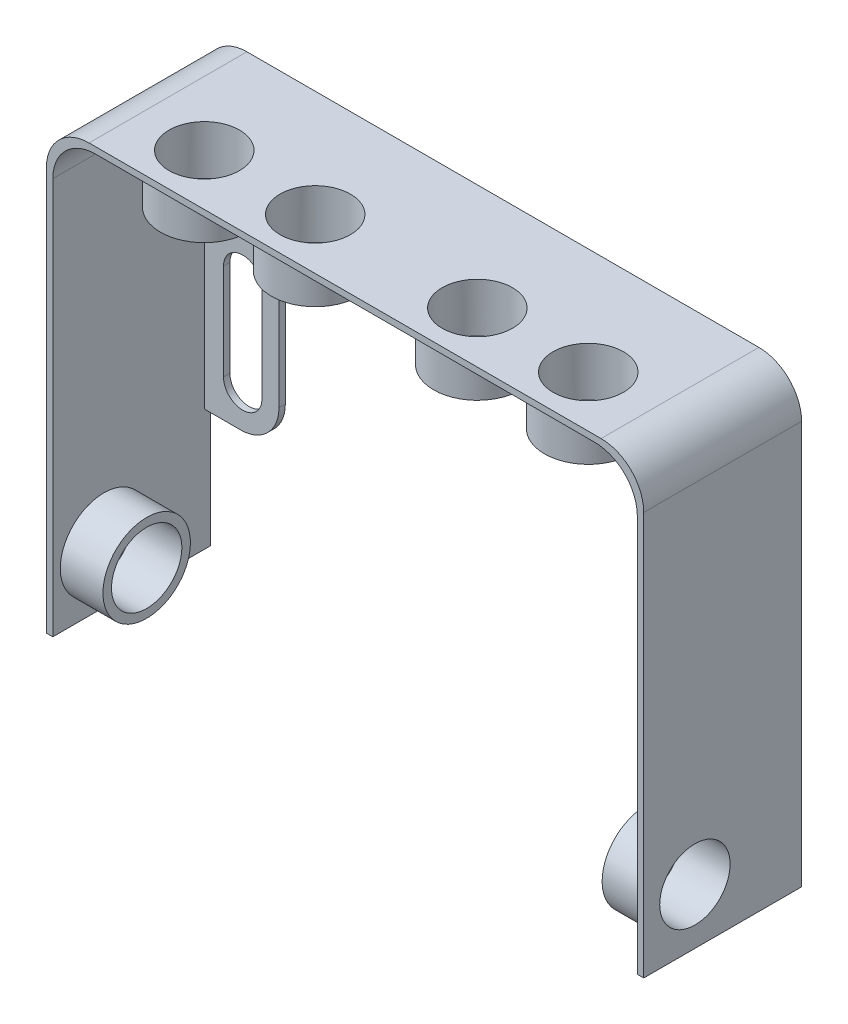
from build123d import *

# Parameters (mm, degrees)
SKIZZE1_W                            = 140
SKIZZE1_H                            = 209.01
SKIZZE1_W_2                          = 137
SKIZZE1_H_2                          = 206.01
AUFSATZ_LINEAR_AUSTRAGEN1_DEPTH      = 37
VERRUNDUNG1_R                        = 10
SKIZZE3_R                            = 8.25
SCHNITT_LINEAR_AUSTRAGEN1_DEPTH      = 1.5
SCHNITT_LINEAR_AUSTRAGEN2_DEPTH      = 255.27186258
SCHNITT_LINEAR_AUSTRAGEN2_DEPTH_BACK = 255.27186258
SKIZZE4_R                            = 8.25
AUFSATZ_LINEAR_AUSTRAGEN3_DEPTH      = 1.5
SCHNITT_LINEAR_AUSTRAGEN3_DEPTH      = 255.057926662
SCHNITT_LINEAR_AUSTRAGEN3_DEPTH_BACK = 255.057926662
SKIZZE6_W                            = 230.516002865
SKIZZE6_H                            = 119.565202556
SKIZZE7_R                            = 10.25
SKIZZE7_R_2                          = 8.25
AUFSATZ_LINEAR_AUSTRAGEN4_DEPTH      = 10
AUFSATZ_LINEAR_START                 = 10
SKIZZE8_R                            = 10.25
SKIZZE8_R_2                          = 8.25
AUFSATZ_LINEAR_AUSTRAGEN5_DEPTH      = 10


with BuildPart() as part:
    # Skizze1 → Aufsatz-Linear austragen1 (new body)
    with BuildSketch(Plane.XY):
        with Locations((70, 104.505)):
            Rectangle(SKIZZE1_W, SKIZZE1_H)
        with Locations((70, 104.505)):
            Rectangle(SKIZZE1_W_2, SKIZZE1_H_2, mode=Mode.SUBTRACT)
    extrude(amount=AUFSATZ_LINEAR_AUSTRAGEN1_DEPTH)

    # Verrundung1
    verrundung1_edges = [part.edges().sort_by_distance(p)[0] for p in [
        (1.5, 207.51, 18.5),
        (1.5, 1.5, 18.5),
        (138.5, 1.5, 18.5),
        (138.5, 207.51, 18.5),
        (0, 209.01, 18.5),
        (140, 209.01, 18.5),
        (140, 0, 18.5),
        (0, 0, 18.5),
    ]]
    fillet(verrundung1_edges, radius=VERRUNDUNG1_R)

    # Skizze3 → Schnitt-Linear austragen1 (cut)
    with BuildSketch(Plane(origin=(0, 209.01, 0), x_dir=(1, 0, 0), z_dir=(0, 1, 0))):
        with Locations(Location((25, -25, 0), (0, 0, 270))):
            Circle(SKIZZE3_R)
        with Locations(Location((51, -25, 0), (0, 0, 270))):
            Circle(SKIZZE3_R)
        with Locations(Location((89, -25, 0), (0, 0, 90))):
            Circle(SKIZZE3_R)
        with Locations(Location((115, -25, 0), (0, 0, 90))):
            Circle(SKIZZE3_R)
    extrude(amount=-SCHNITT_LINEAR_AUSTRAGEN1_DEPTH, mode=Mode.SUBTRACT)

    # Skizze4 → Schnitt-Linear austragen2 (cut, two sides: drawn at the far end of the back side and taken through both)
    with BuildSketch(Plane(origin=(140, 0, 0), x_dir=(0, 0, -1), z_dir=(1, 0, 0)).offset(-SCHNITT_LINEAR_AUSTRAGEN2_DEPTH_BACK)):
        with Locations(Location((-25, 117.505, 0), (0, 0, 270))):
            Circle(SKIZZE4_R)
        with Locations(Location((-25, 91.505, 0), (0, 0, 270))):
            Circle(SKIZZE4_R)
    extrude(amount=SCHNITT_LINEAR_AUSTRAGEN2_DEPTH + SCHNITT_LINEAR_AUSTRAGEN2_DEPTH_BACK, mode=Mode.SUBTRACT)

    # Skizze5 → Aufsatz-Linear austragen3 (add)
    # profile 1 of 5: a face of its own
    with BuildSketch(Plane(origin=(0, 0, 0), x_dir=(-1, 0, 0), z_dir=(0, 0, -1))):
        with BuildLine():
            Line((-140, 173.01), (-130, 173.01))
            ThreePointArc((-130, 173.01), (-123.636038969, 170.373961031), (-121, 164.01))
            Line((-121, 164.01), (-121, 142.01))
            ThreePointArc((-121, 142.01), (-123.636038969, 135.646038969), (-130, 133.01))
            Line((-130, 133.01), (-140, 133.01))
            Line((-140, 133.01), (-140, 173.01))
        make_face()
        with BuildLine():
            Line((-125, 164.26), (-125, 141.76))
            ThreePointArc((-125, 141.76), (-129.5, 137.26), (-134, 141.76))
            Line((-134, 141.76), (-134, 164.26))
            ThreePointArc((-134, 164.26), (-129.5, 168.76), (-125, 164.26))
        make_face(mode=Mode.SUBTRACT)
    # profile 2 of 5: a face of its own
    with BuildSketch(Plane(origin=(0, 0, 0), x_dir=(-1, 0, 0), z_dir=(0, 0, -1))):
        with BuildLine():
            Line((-90, 209.01), (-90, 196.01))
            ThreePointArc((-90, 196.01), (-87.363961031, 189.646038969), (-81, 187.01))
            Line((-81, 187.01), (-59, 187.01))
            ThreePointArc((-59, 187.01), (-52.636038969, 189.646038969), (-50, 196.01))
            Line((-50, 196.01), (-50, 209.01))
            Line((-50, 209.01), (-90, 209.01))
        make_face()
        with BuildLine():
            Line((-58.75, 200.01), (-81.25, 200.01))
            ThreePointArc((-81.25, 200.01), (-85.75, 195.51), (-81.25, 191.01))
            Line((-81.25, 191.01), (-58.75, 191.01))
            ThreePointArc((-58.75, 191.01), (-54.25, 195.51), (-58.75, 200.01))
        make_face(mode=Mode.SUBTRACT)
    # profile 3 of 5: a face of its own
    with BuildSketch(Plane(origin=(0, 0, 0), x_dir=(-1, 0, 0), z_dir=(0, 0, -1))):
        with BuildLine():
            Line((-19, 164.01), (-19, 142.01))
            ThreePointArc((-19, 142.01), (-16.363961031, 135.646038969), (-10, 133.01))
            Line((-10, 133.01), (0, 133.01))
            Line((0, 133.01), (0, 173.01))
            Line((0, 173.01), (-10, 173.01))
            ThreePointArc((-10, 173.01), (-16.363961031, 170.373961031), (-19, 164.01))
        make_face()
        with BuildLine():
            Line((-15, 164.26), (-15, 141.76))
            ThreePointArc((-15, 141.76), (-10.5, 137.26), (-6, 141.76))
            Line((-6, 141.76), (-6, 164.26))
            ThreePointArc((-6, 164.26), (-10.5, 168.76), (-15, 164.26))
        make_face(mode=Mode.SUBTRACT)
    # profile 4 of 5: a face of its own
    with BuildSketch(Plane(origin=(0, 0, 0), x_dir=(-1, 0, 0), z_dir=(0, 0, -1))):
        with BuildLine():
            Line((0, 36), (-10, 36))
            ThreePointArc((-10, 36), (-16.363961031, 38.636038969), (-19, 45))
            Line((-19, 45), (-19, 67))
            ThreePointArc((-19, 67), (-16.363961031, 73.363961031), (-10, 76))
            Line((-10, 76), (0, 76))
            Line((0, 76), (0, 36))
        make_face()
        with BuildLine():
            Line((-15, 44.75), (-15, 67.25))
            ThreePointArc((-15, 67.25), (-10.5, 71.75), (-6, 67.25))
            Line((-6, 67.25), (-6, 44.75))
            ThreePointArc((-6, 44.75), (-10.5, 40.25), (-15, 44.75))
        make_face(mode=Mode.SUBTRACT)
    # profile 5 of 5: a face of its own
    with BuildSketch(Plane(origin=(0, 0, 0), x_dir=(-1, 0, 0), z_dir=(0, 0, -1))):
        with BuildLine():
            Line((-121, 45), (-121, 67))
            ThreePointArc((-121, 67), (-123.636038969, 73.363961031), (-130, 76))
            Line((-130, 76), (-140, 76))
            Line((-140, 76), (-140, 36))
            Line((-140, 36), (-130, 36))
            ThreePointArc((-130, 36), (-123.636038969, 38.636038969), (-121, 45))
        make_face()
        with BuildLine():
            Line((-125, 44.75), (-125, 67.25))
            ThreePointArc((-125, 67.25), (-129.5, 71.75), (-134, 67.25))
            Line((-134, 67.25), (-134, 44.75))
            ThreePointArc((-134, 44.75), (-129.5, 40.25), (-125, 44.75))
        make_face(mode=Mode.SUBTRACT)
    extrude(amount=-AUFSATZ_LINEAR_AUSTRAGEN3_DEPTH)

    # Skizze6 → Schnitt-Linear austragen3 (cut, two sides: drawn at the far end of the back side and taken through both)
    with BuildSketch(Plane.XY.offset(1.5).offset(-SCHNITT_LINEAR_AUSTRAGEN3_DEPTH_BACK)):
        with Locations((84.29357918, 44.722398722)):
            Rectangle(SKIZZE6_W, SKIZZE6_H)
    extrude(amount=SCHNITT_LINEAR_AUSTRAGEN3_DEPTH + SCHNITT_LINEAR_AUSTRAGEN3_DEPTH_BACK, mode=Mode.SUBTRACT)

    # Skizze7 → Aufsatz-Linear austragen4 (add)
    # profile 1 of 4: a face of its own
    with BuildSketch(Plane.XZ.offset(-207.51)):
        with Locations(Location((51, 25, 0), (0, 0, 270))):
            Circle(SKIZZE7_R)
        with Locations(Location((51, 25, 0), (0, 0, 90))):
            Circle(SKIZZE7_R_2, mode=Mode.SUBTRACT)
    # profile 2 of 4: a face of its own
    with BuildSketch(Plane.XZ.offset(-207.51)):
        with Locations(Location((25, 25, 0), (0, 0, 270))):
            Circle(SKIZZE7_R)
        with Locations(Location((25, 25, 0), (0, 0, 90))):
            Circle(SKIZZE7_R_2, mode=Mode.SUBTRACT)
    # profile 3 of 4: a face of its own
    with BuildSketch(Plane.XZ.offset(-207.51)):
        with Locations(Location((115, 25, 0), (0, 0, 90))):
            Circle(SKIZZE7_R)
        with Locations(Location((115, 25, 0), (0, 0, 90))):
            Circle(SKIZZE7_R_2, mode=Mode.SUBTRACT)
    # profile 4 of 4: a face of its own
    with BuildSketch(Plane.XZ.offset(-207.51)):
        with Locations(Location((89, 25, 0), (0, 0, 90))):
            Circle(SKIZZE7_R)
        with Locations(Location((89, 25, 0), (0, 0, 90))):
            Circle(SKIZZE7_R_2, mode=Mode.SUBTRACT)
    extrude(amount=AUFSATZ_LINEAR_AUSTRAGEN4_DEPTH)

    # Skizze8 → Aufsatz-Linear austragen5 (add)
    with BuildSketch(Plane(origin=(1.5, 0, 0), x_dir=(0, 0, -1), z_dir=(1, 0, 0)).offset(AUFSATZ_LINEAR_START)):
        with Locations(Location((-25, 117.505, 0), (0, 0, 90))):
            Circle(SKIZZE8_R)
        with Locations(Location((-25, 117.505, 0), (0, 0, 270))):
            Circle(SKIZZE8_R_2, mode=Mode.SUBTRACT)
    aufsatz_linear_austragen5 = extrude(amount=-AUFSATZ_LINEAR_AUSTRAGEN5_DEPTH)

    # Spiegeln1: Aufsatz-Linear austragen5 across plane
    add(aufsatz_linear_austragen5.mirror(Plane.ZY.offset(-70)))


solid = part.part
